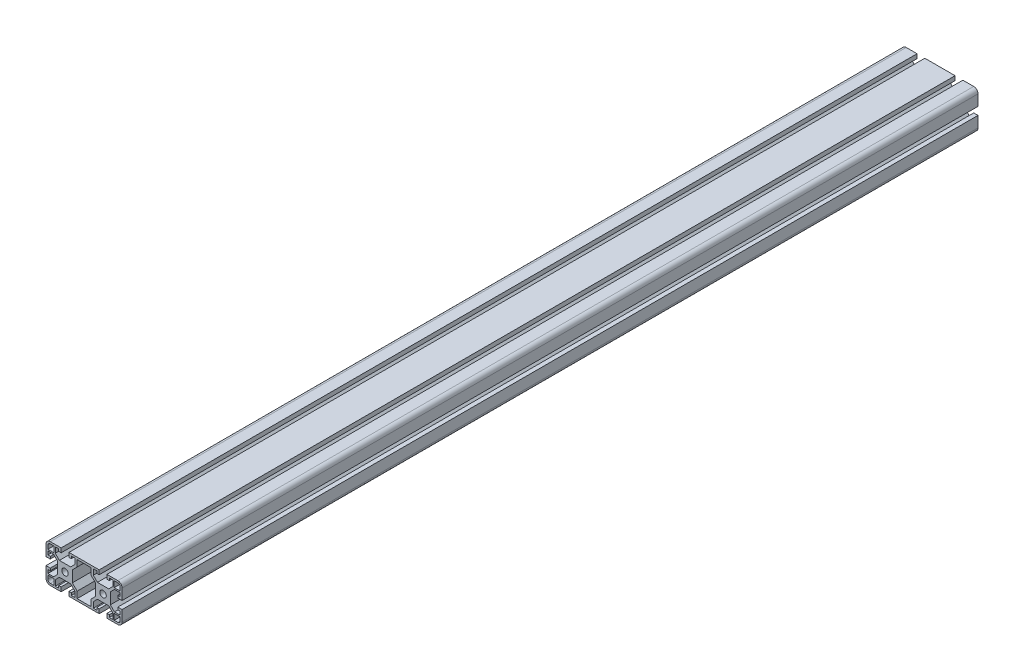
from build123d import *

# Parameters (mm, degrees)
SKETCH1_R           = 3.4
BOSS_EXTRUDE1_DEPTH = 900


with BuildPart() as part:
    # Sketch1 → Boss-Extrude1 (new body)
    with BuildSketch(Plane.XY):
        with BuildLine():
            Line((24.1, -20), (35.5, -20))
            ThreePointArc((35.5, -20), (38.681980515, -18.681980515), (40, -15.5))
            Line((40, -15.5), (40, -4.1))
            Line((40, -4.1), (35.5, -4.1))
            Line((35.5, -4.1), (35.5, -6.6))
            Line((35.5, -6.6), (38, -6.6))
            Line((38, -6.6), (38, -10.25))
            Line((38, -10.25), (32.017766953, -10.25))
            Line((32.017766953, -10.25), (27.7, -5.932233047))
            Line((27.7, -5.932233047), (27.7, 5.932233047))
            Line((27.7, 5.932233047), (32.017766953, 10.25))
            Line((32.017766953, 10.25), (38, 10.25))
            Line((38, 10.25), (38, 6.6))
            Line((38, 6.6), (35.5, 6.6))
            Line((35.5, 6.6), (35.5, 4.1))
            Line((35.5, 4.1), (40, 4.1))
            Line((40, 4.1), (40, 15.5))
            ThreePointArc((40, 15.5), (38.681980515, 18.681980515), (35.5, 20))
            Line((35.5, 20), (24.1, 20))
            Line((24.1, 20), (24.1, 15.5))
            Line((24.1, 15.5), (26.6, 15.5))
            Line((26.6, 15.5), (26.6, 18))
            Line((26.6, 18), (30.25, 18))
            Line((30.25, 18), (30.25, 12.017766953))
            Line((30.25, 12.017766953), (25.932233047, 7.7))
            Line((25.932233047, 7.7), (14.067766953, 7.7))
            Line((14.067766953, 7.7), (9.75, 12.017766953))
            Line((9.75, 12.017766953), (9.75, 18))
            Line((9.75, 18), (13.4, 18))
            Line((13.4, 18), (13.4, 15.5))
            Line((13.4, 15.5), (15.9, 15.5))
            Line((15.9, 15.5), (15.9, 20))
            Line((15.9, 20), (-15.9, 20))
            Line((-15.9, 20), (-15.9, 15.5))
            Line((-15.9, 15.5), (-13.4, 15.5))
            Line((-13.4, 15.5), (-13.4, 18))
            Line((-13.4, 18), (-9.75, 18))
            Line((-9.75, 18), (-9.75, 12.017766953))
            Line((-9.75, 12.017766953), (-14.067766953, 7.7))
            Line((-14.067766953, 7.7), (-25.932233047, 7.7))
            Line((-25.932233047, 7.7), (-30.25, 12.017766953))
            Line((-30.25, 12.017766953), (-30.25, 18))
            Line((-30.25, 18), (-26.6, 18))
            Line((-26.6, 18), (-26.6, 15.5))
            Line((-26.6, 15.5), (-24.1, 15.5))
            Line((-24.1, 15.5), (-24.1, 20))
            Line((-24.1, 20), (-35.5, 20))
            ThreePointArc((-35.5, 20), (-38.681980515, 18.681980515), (-40, 15.5))
            Line((-40, 15.5), (-40, 4.1))
            Line((-40, 4.1), (-35.5, 4.1))
            Line((-35.5, 4.1), (-35.5, 6.6))
            Line((-35.5, 6.6), (-38, 6.6))
            Line((-38, 6.6), (-38, 10.25))
            Line((-38, 10.25), (-32.017766953, 10.25))
            Line((-32.017766953, 10.25), (-27.7, 5.932233047))
            Line((-27.7, 5.932233047), (-27.7, -5.932233047))
            Line((-27.7, -5.932233047), (-32.017766953, -10.25))
            Line((-32.017766953, -10.25), (-38, -10.25))
            Line((-38, -10.25), (-38, -6.6))
            Line((-38, -6.6), (-35.5, -6.6))
            Line((-35.5, -6.6), (-35.5, -4.1))
            Line((-35.5, -4.1), (-40, -4.1))
            Line((-40, -4.1), (-40, -15.5))
            ThreePointArc((-40, -15.5), (-38.681980515, -18.681980515), (-35.5, -20))
            Line((-35.5, -20), (-24.1, -20))
            Line((-24.1, -20), (-24.1, -15.5))
            Line((-24.1, -15.5), (-26.6, -15.5))
            Line((-26.6, -15.5), (-26.6, -18))
            Line((-26.6, -18), (-30.25, -18))
            Line((-30.25, -18), (-30.25, -12.017766953))
            Line((-30.25, -12.017766953), (-25.932233047, -7.7))
            Line((-25.932233047, -7.7), (-14.067766953, -7.7))
            Line((-14.067766953, -7.7), (-9.75, -12.017766953))
            Line((-9.75, -12.017766953), (-9.75, -18))
            Line((-9.75, -18), (-13.4, -18))
            Line((-13.4, -18), (-13.4, -15.5))
            Line((-13.4, -15.5), (-15.9, -15.5))
            Line((-15.9, -15.5), (-15.9, -20))
            Line((-15.9, -20), (15.9, -20))
            Line((15.9, -20), (15.9, -15.5))
            Line((15.9, -15.5), (13.4, -15.5))
            Line((13.4, -15.5), (13.4, -18))
            Line((13.4, -18), (9.75, -18))
            Line((9.75, -18), (9.75, -12.017766953))
            Line((9.75, -12.017766953), (14.067766953, -7.7))
            Line((14.067766953, -7.7), (25.932233047, -7.7))
            Line((25.932233047, -7.7), (30.25, -12.017766953))
            Line((30.25, -12.017766953), (30.25, -18))
            Line((30.25, -18), (26.6, -18))
            Line((26.6, -18), (26.6, -15.5))
            Line((26.6, -15.5), (24.1, -15.5))
            Line((24.1, -15.5), (24.1, -20))
        make_face()
        with Locations((-20, 0)):
            Circle(SKETCH1_R, mode=Mode.SUBTRACT)
        with Locations((20, 0)):
            Circle(SKETCH1_R, mode=Mode.SUBTRACT)
        with BuildLine():
            Line((38, -15.5), (38, -11.75))
            Line((38, -11.75), (31.75, -11.75))
            Line((31.75, -11.75), (31.75, -18))
            Line((31.75, -18), (35.5, -18))
            ThreePointArc((35.5, -18), (37.267766953, -17.267766953), (38, -15.5))
        make_face(mode=Mode.SUBTRACT)
        with BuildLine():
            Line((-38, 15.5), (-38, 11.75))
            Line((-38, 11.75), (-31.75, 11.75))
            Line((-31.75, 11.75), (-31.75, 18))
            Line((-31.75, 18), (-35.5, 18))
            ThreePointArc((-35.5, 18), (-37.267766953, 17.267766953), (-38, 15.5))
        make_face(mode=Mode.SUBTRACT)
        Polygon((-7.25, -10.982233047), (-7.25, -17.8), (7.25, -17.8), (7.25, -10.982233047), (12.3, -5.932233047), (12.3, 5.932233047), (7.25, 10.982233047), (7.25, 17.8), (-7.25, 17.8), (-7.25, 10.982233047), (-12.3, 5.932233047), (-12.3, -5.932233047), align=None, mode=Mode.SUBTRACT)
        with BuildLine():
            Line((-35.5, -18), (-31.75, -18))
            Line((-31.75, -18), (-31.75, -11.75))
            Line((-31.75, -11.75), (-38, -11.75))
            Line((-38, -11.75), (-38, -15.5))
            ThreePointArc((-38, -15.5), (-37.267766953, -17.267766953), (-35.5, -18))
        make_face(mode=Mode.SUBTRACT)
        with BuildLine():
            Line((35.5, 18), (31.75, 18))
            Line((31.75, 18), (31.75, 11.75))
            Line((31.75, 11.75), (38, 11.75))
            Line((38, 11.75), (38, 15.5))
            ThreePointArc((38, 15.5), (37.267766953, 17.267766953), (35.5, 18))
        make_face(mode=Mode.SUBTRACT)
    extrude(amount=BOSS_EXTRUDE1_DEPTH)


solid = part.part
